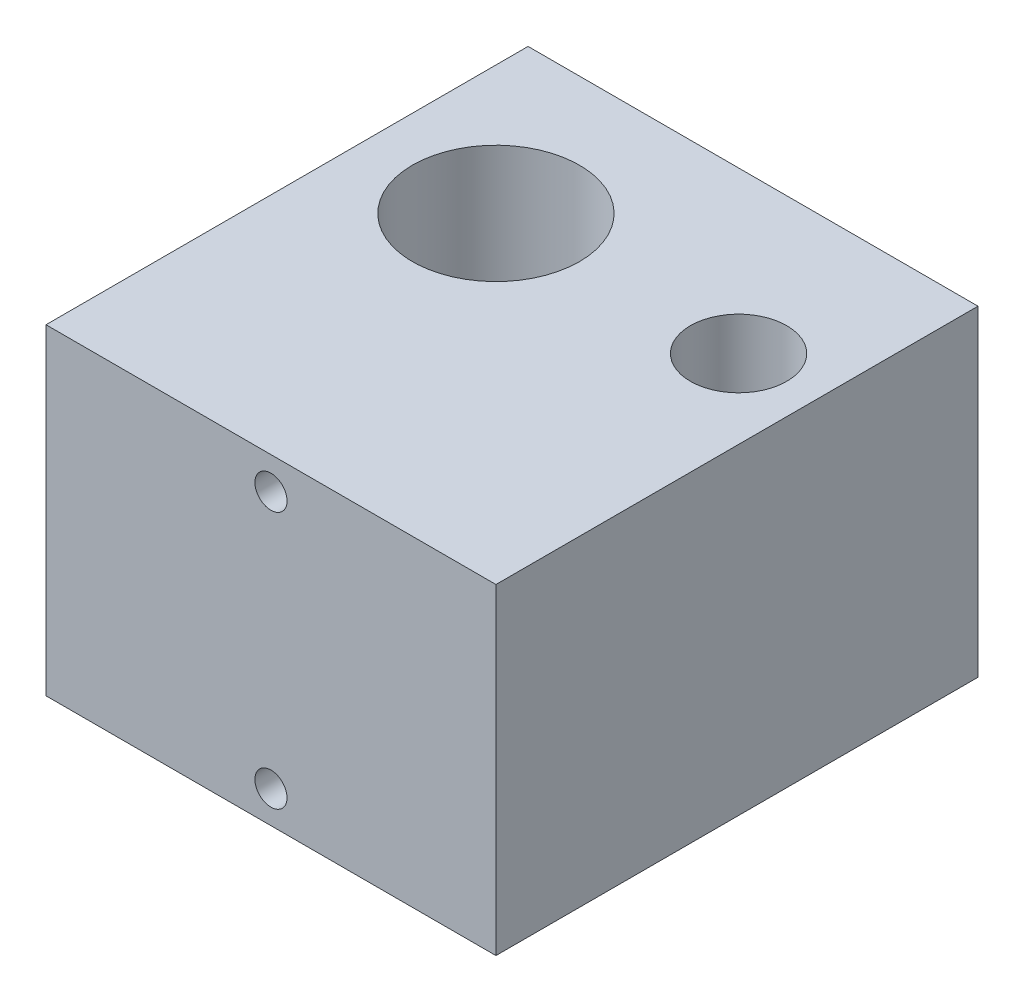
from build123d import *

# Parameters (mm, degrees)
SKETCH1_W           = 70
SKETCH1_H           = 50
BOSS_EXTRUDE1_DEPTH = 75
CUT_EXTRUDE1_REACH  = 98.695
SKETCH2_R           = 7.5
SKETCH2_R_2         = 13
SKETCH3_R           = 2.5
CUT_EXTRUDE2_DEPTH  = 20


with BuildPart() as part:
    # Sketch1 → Boss-Extrude1 (new body)
    with BuildSketch(Plane.XY):
        Rectangle(SKETCH1_W, SKETCH1_H)
    extrude(amount=BOSS_EXTRUDE1_DEPTH)

    # Sketch2 → Cut-Extrude1 (cut, up to next)
    with BuildSketch(Plane(origin=(0, 25, 0), x_dir=(1, 0, 0), z_dir=(0, 1, 0)), mode=Mode.PRIVATE) as cut_extrude1_sk1:
        with Locations(Location((22.75, -25, 0), (0, 0, 180))):
            Circle(SKETCH2_R)
    cut_extrude1_tool1 = extrude(cut_extrude1_sk1.sketch, amount=-CUT_EXTRUDE1_REACH, mode=Mode.PRIVATE) & part.part
    # Sketch2 → Cut-Extrude1 (cut, up to next)
    with BuildSketch(Plane(origin=(0, 25, 0), x_dir=(1, 0, 0), z_dir=(0, 1, 0)), mode=Mode.PRIVATE) as cut_extrude1_sk2:
        with Locations(Location((-15, -25, 0), (0, 0, 180))):
            Circle(SKETCH2_R_2)
    cut_extrude1_tool2 = extrude(cut_extrude1_sk2.sketch, amount=-CUT_EXTRUDE1_REACH, mode=Mode.PRIVATE) & part.part
    add(cut_extrude1_tool1.solids().sort_by_distance((22.75, 25, 25))[0], mode=Mode.SUBTRACT)
    add(cut_extrude1_tool2.solids().sort_by_distance((-15, 25, 25))[0], mode=Mode.SUBTRACT)

    # Sketch3 → Cut-Extrude2 (cut)
    with BuildSketch(Plane.XY.offset(75)):
        with Locations((0, -20)):
            Circle(SKETCH3_R)
        with Locations(Location((0, 20, 0), (0, 0, 180))):
            Circle(SKETCH3_R)
    extrude(amount=-CUT_EXTRUDE2_DEPTH, mode=Mode.SUBTRACT)


solid = part.part
